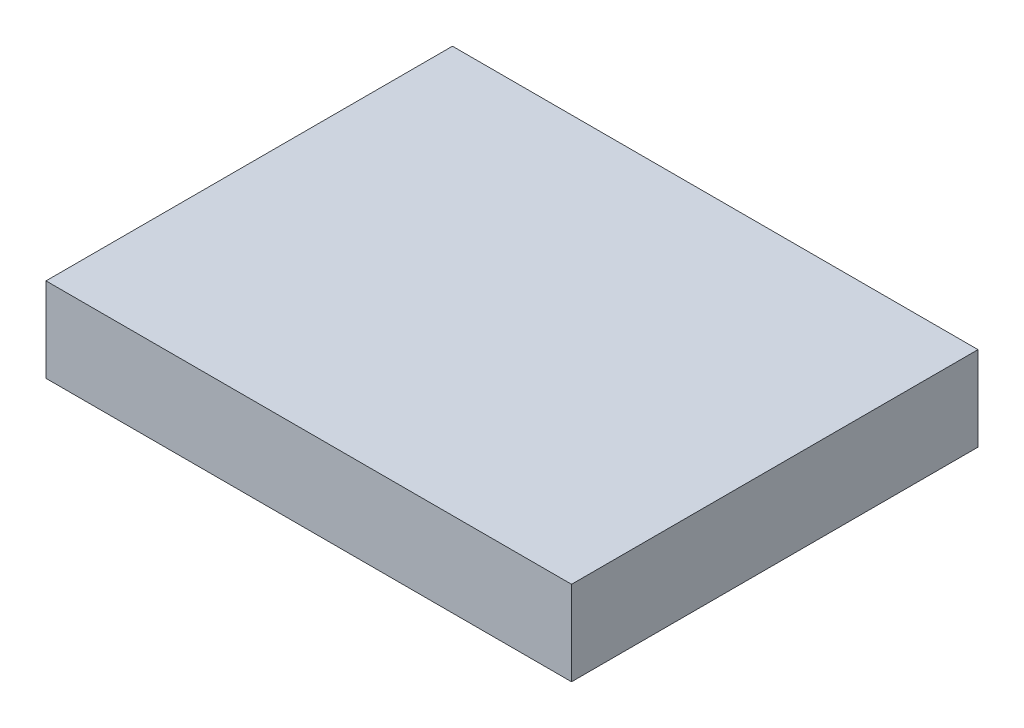
from build123d import *

# Parameters (mm, degrees)
SKETCH1_W      = 137.507065568
SKETCH1_H      = 28.575
EXTRUDE1_DEPTH = 177.8


with BuildPart() as part:
    # Sketch1 → Extrude1 (new body)
    with BuildSketch(Plane(origin=(0, 0, 0), x_dir=(0, 0, -1), z_dir=(1, 0, 0))):
        with Locations((0, 11.1125)):
            Rectangle(SKETCH1_W, SKETCH1_H)
    extrude(amount=-EXTRUDE1_DEPTH)


solid = part.part
